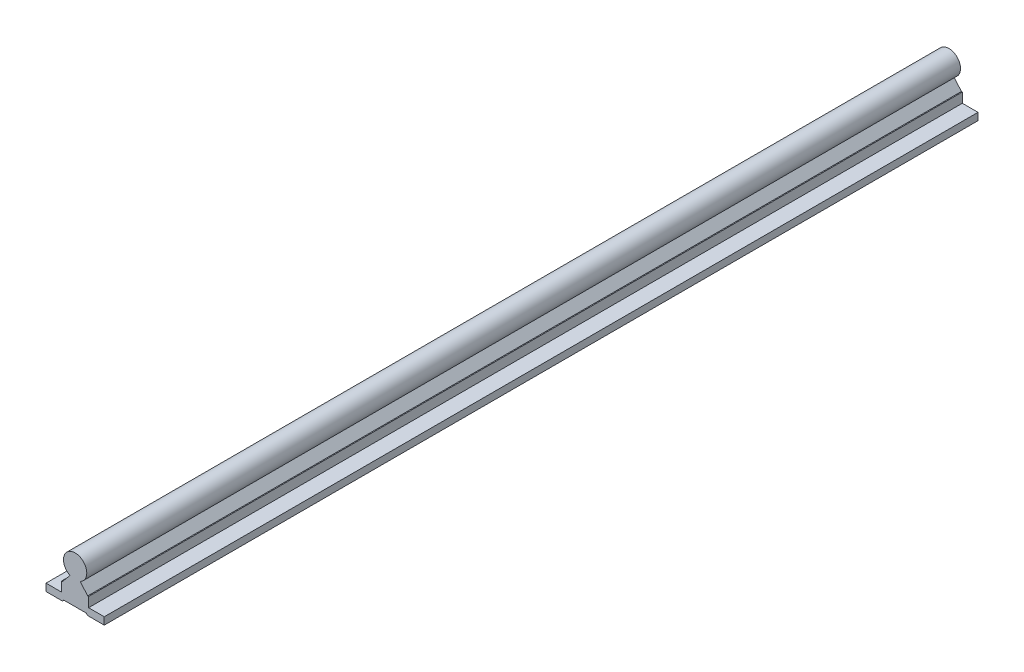
from build123d import *

# Parameters (mm, degrees)
DODANIE_WYCI_GNI_CIE1_DEPTH = 600


with BuildPart() as part:
    # Szkic1 → Dodanie-wyciągnięcie1 (new body)
    with BuildSketch(Plane.XY):
        with BuildLine():
            Line((-3.487119155, 17.8), (-8.605626905, 11.7))
            Line((-8.605626905, 11.7), (-9.25, 11.7))
            Line((-9.25, 11.7), (-9.25, 5))
            Line((-9.25, 5), (-20, 5))
            Line((-20, 5), (-20, 0))
            Line((-20, 0), (-8.605626905, 0))
            Line((-8.605626905, 0), (-7.766527274, 1))
            Line((-7.766527274, 1), (7.766527274, 1))
            Line((7.766527274, 1), (8.605626905, 0))
            Line((8.605626905, 0), (20, 0))
            Line((20, 0), (20, 5))
            Line((20, 5), (9.25, 5))
            Line((9.25, 5), (9.25, 11.7))
            Line((9.25, 11.7), (8.605626905, 11.7))
            Line((8.605626905, 11.7), (3.487119155, 17.8))
            ThreePointArc((3.487119155, 17.8), (0, 33), (-3.487119155, 17.8))
        make_face()
    extrude(amount=DODANIE_WYCI_GNI_CIE1_DEPTH)


solid = part.part
